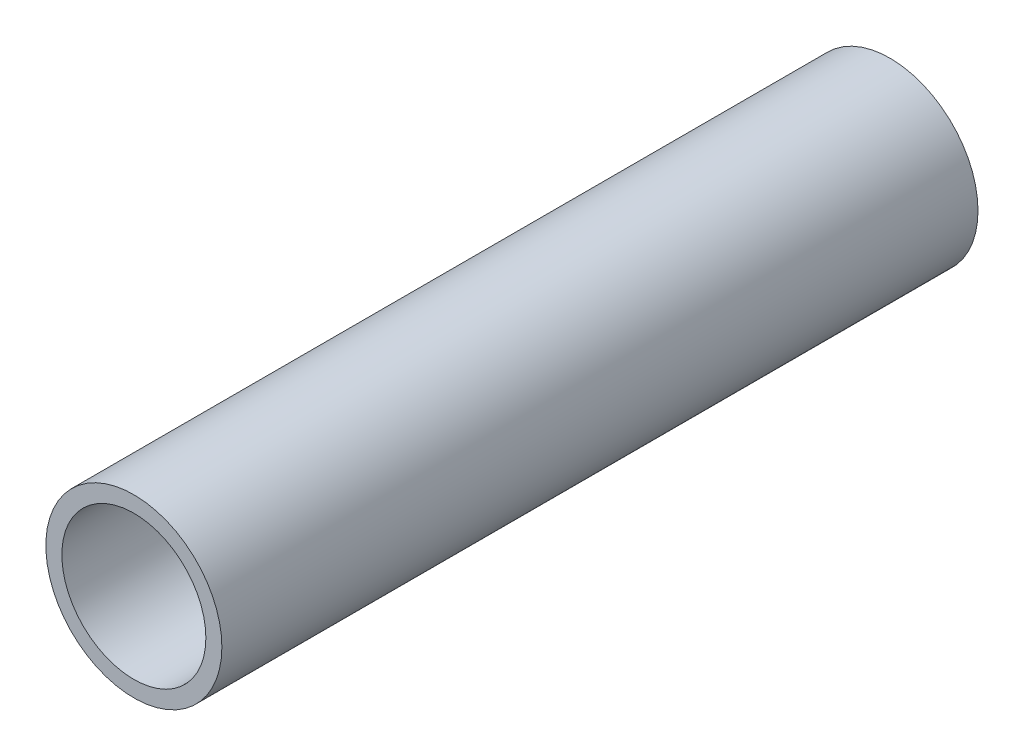
from build123d import *

# Parameters (mm, degrees)
SKETCH_1_R      = 11
SKETCH_1_R_2    = 9
EXTRUDE_1_DEPTH = 94.5


with BuildPart() as part:
    # 스케치1 → 보스-돌출1 (new body)
    with BuildSketch(Plane.XY):
        Circle(SKETCH_1_R)
        Circle(SKETCH_1_R_2, mode=Mode.SUBTRACT)
    extrude(amount=EXTRUDE_1_DEPTH)


solid = part.part
